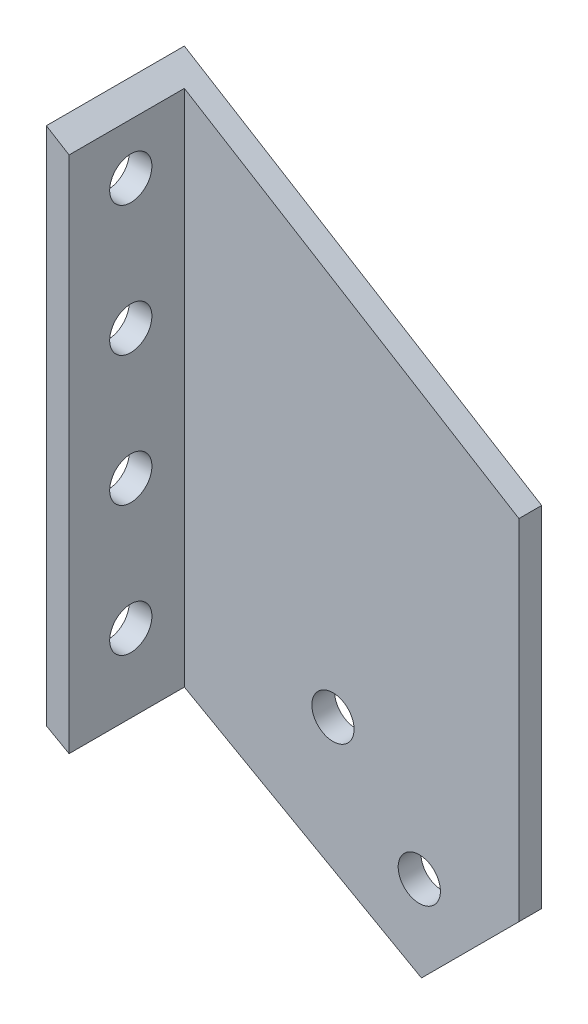
from build123d import *

# Parameters (mm, degrees)
SKETCH_1_R             = 13
EXTRUDE_1_DEPTH        = 14
EXTRUDE_2_DEPTH        = 71
SKETCH_3_R             = 13
CUT_EXTRUDE_1_DEPTH    = 402.319595452
PATTERN_LINEAR_1_COUNT = 4
PATTERN_LINEAR_1_PITCH = 80


with BuildPart() as part:
    # 草图1 → 凸台-拉伸1 (new body)
    with BuildSketch(Plane.XY):
        Polygon((71.4349048, -49.703584356), (71.4349048, -264.703584356), (11.4349048, -324.703584356), (-148.5650952, -234.703584356), (-148.5650952, 85.296415644), align=None)
        with Locations((-43.0650952, -212.828584356)):
            Circle(SKETCH_1_R, mode=Mode.SUBTRACT)
        with Locations((10.084011906, -272.621329851)):
            Circle(SKETCH_1_R, mode=Mode.SUBTRACT)
    extrude(amount=EXTRUDE_1_DEPTH)

    # 草图2 → 凸台-拉伸2 (add)
    with BuildSketch(Plane.XY.offset(14)):
        Polygon((-134.5650952, 76.705506553), (-134.5650952, -242.578584356), (-148.5650952, -234.703584356), (-148.5650952, 85.296415644), align=None)
    extrude(amount=EXTRUDE_2_DEPTH)

    # 草图3 → 切除-拉伸1 (cut, through all)
    with BuildSketch(Plane.ZY.offset(148.5650952)):
        with Locations((47, 45.296415644)):
            Circle(SKETCH_3_R)
    cut_extrude_1 = extrude(amount=-CUT_EXTRUDE_1_DEPTH, mode=Mode.SUBTRACT)

    # 阵列(线性)1: 切除-拉伸1 ×4
    with Locations(*[(0, -i * PATTERN_LINEAR_1_PITCH, 0) for i in range(1, PATTERN_LINEAR_1_COUNT)]):
        add(cut_extrude_1, mode=Mode.SUBTRACT)


solid = part.part
